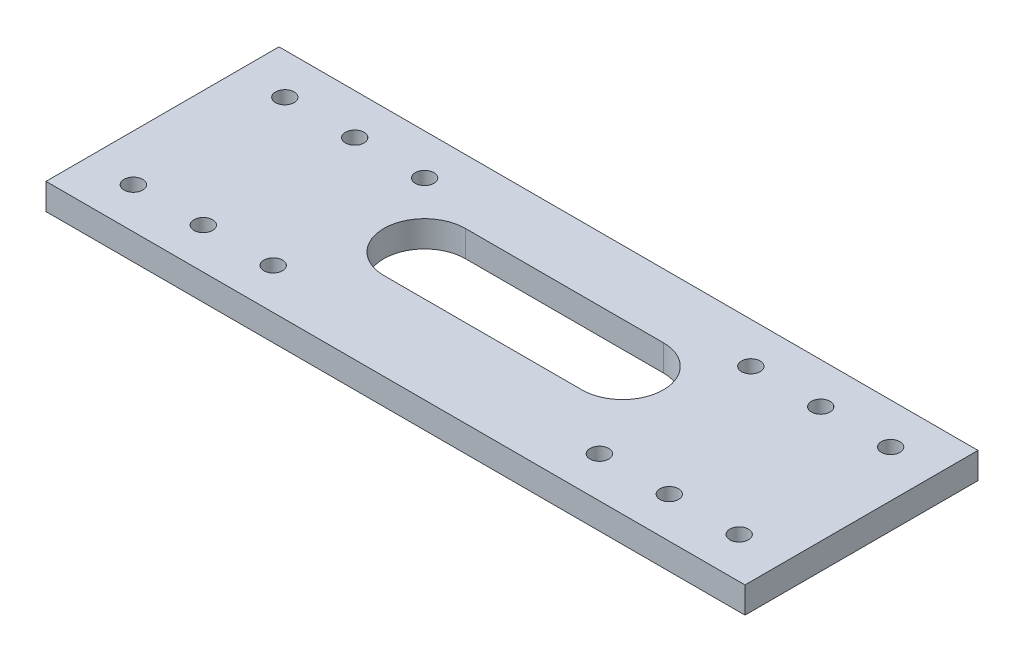
from build123d import *

# Parameters (mm, degrees)
SKETCH_1_W          = 120
SKETCH_1_H          = 40
EXTRUDE_1_DEPTH     = 4.5
SKETCH_2_R          = 1.6
CUT_EXTRUDE_1_DEPTH = 127.571126249


with BuildPart() as part:
    # 草图1 → 凸台-拉伸1 (new body)
    with BuildSketch(Plane(origin=(0, 0, 0), x_dir=(1, 0, 0), z_dir=(0, 1, 0))):
        with Locations((60, 20)):
            Rectangle(SKETCH_1_W, SKETCH_1_H)
    extrude(amount=EXTRUDE_1_DEPTH)

    # 草图2 → 切除-拉伸1 (cut, through all)
    with BuildSketch(Plane.XZ):
        with Locations(Location((8, -7, 0), (0, 0, 270))):
            Circle(SKETCH_2_R)
        with Locations(Location((32, -33, 0), (0, 0, 270))):
            Circle(SKETCH_2_R)
        with Locations(Location((32, -7, 0), (0, 0, 270))):
            Circle(SKETCH_2_R)
        with Locations(Location((100, -33, 0), (0, 0, 270))):
            Circle(SKETCH_2_R)
        with Locations(Location((20, -33, 0), (0, 0, 270))):
            Circle(SKETCH_2_R)
        with Locations(Location((100, -7, 0), (0, 0, 270))):
            Circle(SKETCH_2_R)
        with Locations(Location((20, -7, 0), (0, 0, 270))):
            Circle(SKETCH_2_R)
        with Locations(Location((112, -33, 0), (0, 0, 270))):
            Circle(SKETCH_2_R)
        with Locations(Location((112, -7, 0), (0, 0, 270))):
            Circle(SKETCH_2_R)
        with Locations(Location((8, -33, 0), (0, 0, 270))):
            Circle(SKETCH_2_R)
        with Locations(Location((88, -33, 0), (0, 0, 270))):
            Circle(SKETCH_2_R)
        with Locations(Location((88, -7, 0), (0, 0, 270))):
            Circle(SKETCH_2_R)
        with BuildLine():
            Line((77, -15), (43, -15))
            ThreePointArc((43, -15), (36, -22), (43, -29))
            Line((43, -29), (77, -29))
            ThreePointArc((77, -29), (84, -22), (77, -15))
        make_face()
    extrude(amount=-CUT_EXTRUDE_1_DEPTH, mode=Mode.SUBTRACT)


solid = part.part
